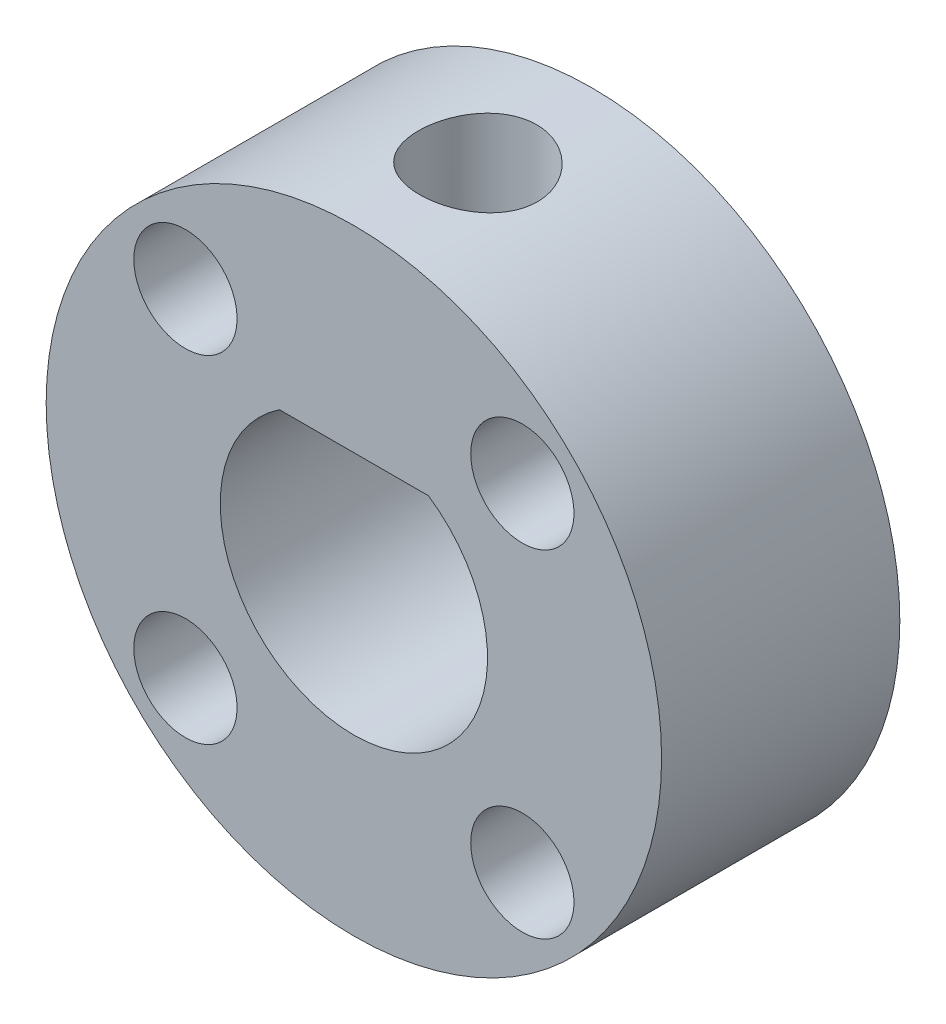
from build123d import *

# Parameters (mm, degrees)
SKETCH1_W                    = 7.75
SKETCH1_H                    = 6
CUT_EXTRUDE1_DEPTH           = 13.494999
F_3_0_3_DIAMETER_HOLE1_D     = 3
F_3_0_3_DIAMETER_HOLE1_DEPTH = 4.956
F_2_6_2_6_DIAMETER_HOLE1_D   = 2.6


with BuildPart() as part:
    # Sketch1 → Revolve1 (revolve)
    with BuildSketch(Plane(origin=(0, 0, 0), x_dir=(1, 0, 0), z_dir=(0, 1, 0))):
        with Locations((3.875, -3)):
            Rectangle(SKETCH1_W, SKETCH1_H)
    revolve(axis=Axis((0, 0, 0), (0, 0, 1)))

    # Sketch2 → Cut-Extrude1 (cut, through all)
    with BuildSketch(Plane(origin=(0, 0, 0), x_dir=(-1, 0, 0), z_dir=(0, 0, -1))):
        with BuildLine():
            Line((1.876207411, 2.794), (-1.876207411, 2.794))
            ThreePointArc((-1.876207411, 2.794), (0, -3.3655), (1.876207411, 2.794))
        make_face()
    extrude(amount=-CUT_EXTRUDE1_DEPTH, mode=Mode.SUBTRACT)

    # Ø3.0 (3) Diameter Hole1
    with Locations(Plane(origin=(0, 2.794, 0), x_dir=(-1, 0, 0), z_dir=(0, -1, 0))):
        with Locations((-0.123792589, -3)):
            Hole(F_3_0_3_DIAMETER_HOLE1_D / 2, depth=F_3_0_3_DIAMETER_HOLE1_DEPTH)

    # Ø2.6 (2.6) Diameter Hole1 (through all)
    with Locations(Plane(origin=(0, 0, 0), x_dir=(-1, 0, 0), z_dir=(0, 0, -1))):
        with Locations((-4.242640687, -4.242640687), (4.242640687, 4.242640687), (-4.242640687, 4.242640687), (4.242640687, -4.242640687)):
            Hole(F_2_6_2_6_DIAMETER_HOLE1_D / 2)


solid = part.part
